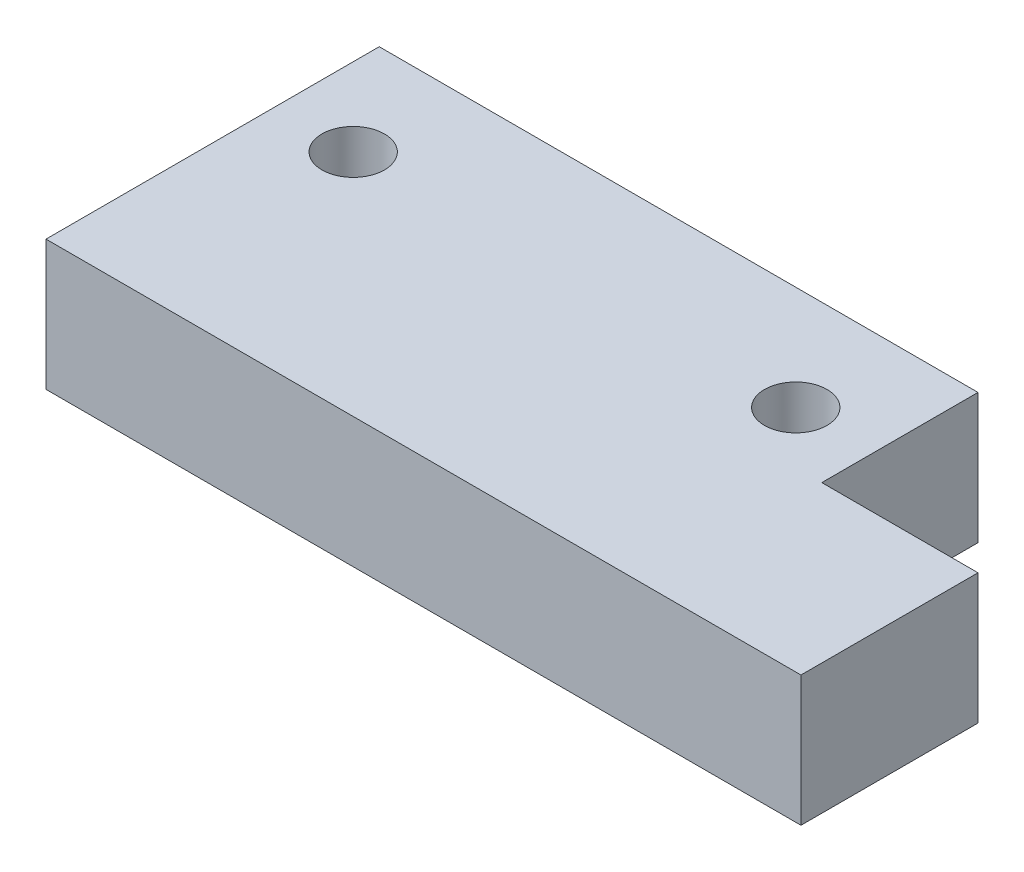
from build123d import *

# Parameters (mm, degrees)
SKETCH_1_W           = 35
SKETCH_1_H           = 20
EXTRUDE_1_DEPTH      = 5
SKETCH_3_W           = 29
SKETCH_3_H           = 7.2
CUT_EXTRUDE_4_DEPTH  = 5
SKETCH_4_W           = 6
SKETCH_4_H           = 6
CUT_EXTRUDE_5_DEPTH  = 5
SKETCH_5_R           = 1.2
CUT_EXTRUDE_6_DEPTH  = 41.620192023
SKETCH_6_R           = 2.2
CUT_EXTRUDE_7_DEPTH  = 2
CUT_EXTRUDE_START    = 5
SKETCH_7_R           = 2.2
CUT_EXTRUDE_8_DEPTH  = 3
SKETCH_8_W           = 40.267995894
SKETCH_8_H           = 24.754572762
CUT_EXTRUDE_9_DEPTH  = 41.620192023
SKETCH_11_W          = 6
SKETCH_11_H          = 20
CUT_EXTRUDE_11_DEPTH = 41.620192023


with BuildPart() as part:
    # 草圖1 → 填料-伸長1 (new body)
    with BuildSketch(Plane(origin=(0, 0, 0), x_dir=(1, 0, 0), z_dir=(0, 1, 0))):
        with Locations((17.5, 10)):
            Rectangle(SKETCH_1_W, SKETCH_1_H)
    extrude_1 = extrude(amount=EXTRUDE_1_DEPTH)

    # 草圖3 → 除料-伸長4 (cut)
    with BuildSketch(Plane(origin=(0, 0, 0), x_dir=(1, 0, 0), z_dir=(0, 1, 0))):
        with Locations((20.5, 3.6)):
            Rectangle(SKETCH_3_W, SKETCH_3_H)
    cut_extrude_4 = extrude(amount=CUT_EXTRUDE_4_DEPTH, mode=Mode.SUBTRACT)

    # 草圖4 → 除料-伸長5 (cut)
    with BuildSketch(Plane(origin=(0, 0, 0), x_dir=(1, 0, 0), z_dir=(0, 1, 0))):
        with Locations((32, 17)):
            Rectangle(SKETCH_4_W, SKETCH_4_H)
    cut_extrude_5 = extrude(amount=CUT_EXTRUDE_5_DEPTH, mode=Mode.SUBTRACT)

    # 草圖5 → 除料-伸長6 (cut, through all)
    with BuildSketch(Plane(origin=(0, 0, 0), x_dir=(1, 0, 0), z_dir=(0, 1, 0))):
        with Locations(Location((3, 16, 0), (0, 0, 270))):
            Circle(SKETCH_5_R)
        with Locations(Location((3, 4, 0), (0, 0, 270))):
            Circle(SKETCH_5_R)
        with Locations(Location((9, 16, 0), (0, 0, 270))):
            Circle(SKETCH_5_R)
        with Locations(Location((26, 16, 0), (0, 0, 270))):
            Circle(SKETCH_5_R)
    cut_extrude_6 = extrude(amount=CUT_EXTRUDE_6_DEPTH, mode=Mode.SUBTRACT)

    # 草圖6 → 除料-伸長7 (cut)
    with BuildSketch(Plane(origin=(0, 0, 0), x_dir=(1, 0, 0), z_dir=(0, 1, 0))):
        with Locations(Location((3, 16, 0), (0, 0, 270))):
            Circle(SKETCH_6_R)
        with Locations(Location((3, 4, 0), (0, 0, 270))):
            Circle(SKETCH_6_R)
    cut_extrude_7 = extrude(amount=CUT_EXTRUDE_7_DEPTH, mode=Mode.SUBTRACT)

    # 草圖7 → 除料-伸長8 (cut)
    with BuildSketch(Plane(origin=(0, 0, 0), x_dir=(1, 0, 0), z_dir=(0, 1, 0)).offset(CUT_EXTRUDE_START)):
        with Locations(Location((9, 16, 0), (0, 0, 90))):
            Circle(SKETCH_7_R)
        with Locations(Location((26, 16, 0), (0, 0, 90))):
            Circle(SKETCH_7_R)
    cut_extrude_8 = extrude(amount=-CUT_EXTRUDE_8_DEPTH, mode=Mode.SUBTRACT)

    # 鏡射1: 填料-伸長1, 除料-伸長4, 除料-伸長5, 除料-伸長6, 除料-伸長7, 除料-伸長8 across plane
    add(extrude_1.mirror(Plane.ZX))
    add(cut_extrude_4.mirror(Plane.ZX), mode=Mode.SUBTRACT)
    add(cut_extrude_5.mirror(Plane.ZX), mode=Mode.SUBTRACT)
    add(cut_extrude_6.mirror(Plane.ZX), mode=Mode.SUBTRACT)
    add(cut_extrude_7.mirror(Plane.ZX), mode=Mode.SUBTRACT)
    add(cut_extrude_8.mirror(Plane.ZX), mode=Mode.SUBTRACT)

    # 草圖8 → 除料-伸長9 (cut, through all)
    with BuildSketch(Plane(origin=(0, 0, 0), x_dir=(1, 0, 0), z_dir=(0, 1, 0))):
        with Locations((18.825302285, 8.624835494)):
            Rectangle(SKETCH_8_W, SKETCH_8_H)
    extrude(amount=CUT_EXTRUDE_9_DEPTH, mode=Mode.SUBTRACT)

    # 草圖11 → 除料-伸長11 (cut, through all)
    with BuildSketch(Plane(origin=(0, 0, 0), x_dir=(1, 0, 0), z_dir=(0, 1, 0))):
        with Locations((3, 10)):
            Rectangle(SKETCH_11_W, SKETCH_11_H)
    extrude(amount=-CUT_EXTRUDE_11_DEPTH, mode=Mode.SUBTRACT)


solid = part.part
